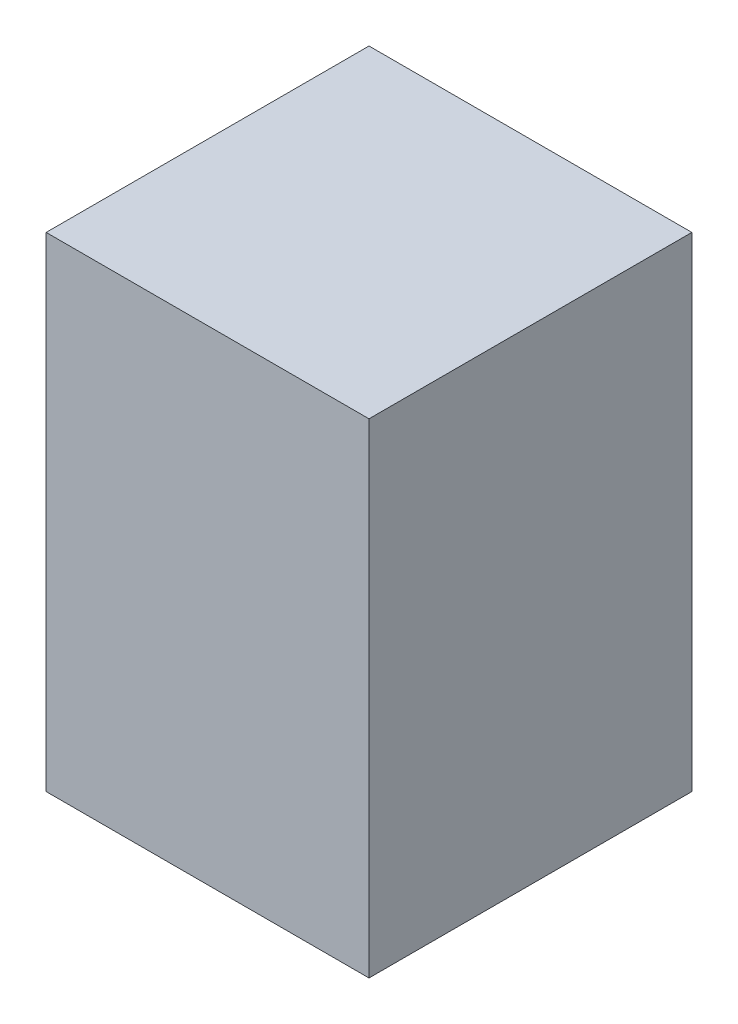
from build123d import *

# Parameters (mm, degrees)
SKETCH1_W           = 4000
SKETCH1_H           = 4000
BOSS_EXTRUDE1_DEPTH = 6000


with BuildPart() as part:
    # Sketch1 → Boss-Extrude1 (new body)
    with BuildSketch(Plane(origin=(0, 0, 0), x_dir=(1, 0, 0), z_dir=(0, 1, 0))):
        Rectangle(SKETCH1_W, SKETCH1_H)
    extrude(amount=BOSS_EXTRUDE1_DEPTH)


solid = part.part
